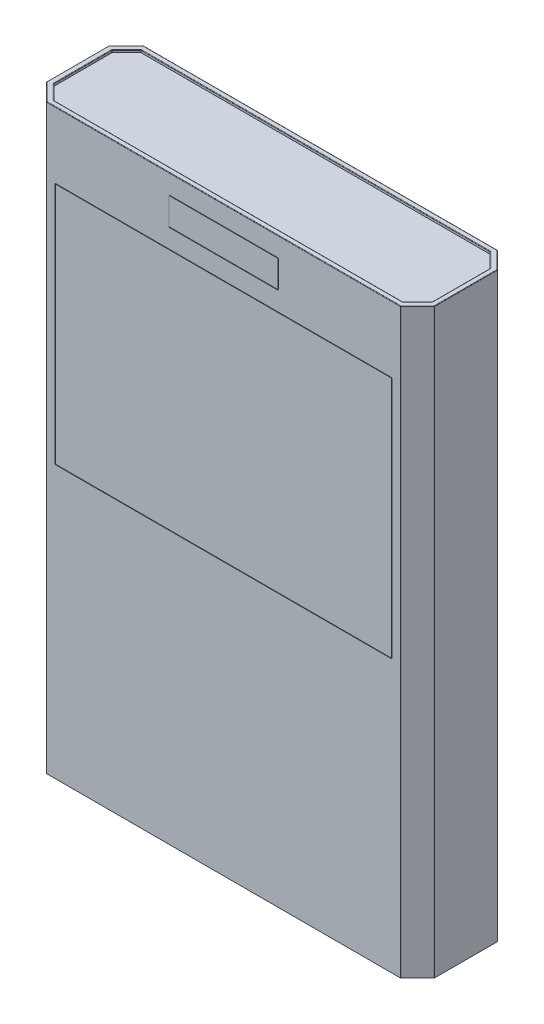
from build123d import *

# Parameters (mm, degrees)
SKETCH2_W           = 80
SKETCH2_H           = 120
BOSS_EXTRUDE1_DEPTH = 20
CHAMFER1_SIZE       = 3.5
CUT_EXTRUDE1_DEPTH  = 0.5
FILLET1_R           = 0.1
SKETCH4_W           = 22.384
SKETCH4_H           = 5.584
CUT_EXTRUDE2_DEPTH  = 0.1
SKETCH6_W           = 69.22
SKETCH6_H           = 50.02
CUT_EXTRUDE4_DEPTH  = 0.1


with BuildPart() as part:
    # Sketch2 → Boss-Extrude1 (new body)
    with BuildSketch(Plane.XY):
        Rectangle(SKETCH2_W, SKETCH2_H)
    extrude(amount=BOSS_EXTRUDE1_DEPTH)

    # Chamfer1
    chamfer1_edges = [part.edges().sort_by_distance(p)[0] for p in [
        (-40, 0, 20),
        (40, 0, 20),
        (-40, 0, 0),
        (40, 0, 0),
    ]]
    chamfer(chamfer1_edges, length=CHAMFER1_SIZE)

    # Sketch3 → Cut-Extrude1 (cut)
    with BuildSketch(Plane(origin=(0, 60, 0), x_dir=(1, 0, 0), z_dir=(0, 1, 0))):
        Polygon((-36, -19), (36, -19), (39, -16), (39, -4), (36, -1), (-36, -1), (-39, -4), (-39, -16), align=None)
    extrude(amount=-CUT_EXTRUDE1_DEPTH, mode=Mode.SUBTRACT)

    # Fillet1
    fillet1_edges = [part.edges().sort_by_distance(p)[0] for p in [
        (-40, 0, 16.5),
        (-40, 0, 3.5),
        (0, 60, 0),
        (36.5, 0, 0),
        (-36.5, 0, 0),
        (0, 60, 20),
        (40, 60, 10),
        (38.25, 60, 1.75),
        (38.25, 60, 18.25),
        (-38.25, 60, 18.25),
        (-38.25, 60, 1.75),
        (36.5, 0, 20),
        (-36.5, 0, 20),
        (40, 0, 3.5),
        (40, 0, 16.5),
        (-37.5, 60, 2.5),
        (-39, 59.75, 4),
        (0, 60, 1),
        (-36, 59.75, 1),
        (37.5, 60, 2.5),
        (36, 59.75, 1),
        (39, 59.75, 4),
        (39, 59.75, 16),
        (36, 59.75, 19),
        (-36, 59.75, 19),
        (-39, 60, 10),
        (-39, 59.75, 16),
        (-37.5, 60, 17.5),
        (0, 60, 19),
        (37.5, 60, 17.5),
        (39, 60, 10),
    ]]
    fillet(fillet1_edges, radius=FILLET1_R)

    # Sketch4 → Cut-Extrude2 (cut)
    with BuildSketch(Plane.XY.offset(20)):
        with BuildLine():
            Line((-11.192, 50.208), (11.192, 50.208))
            ThreePointArc((11.192, 50.208), (11.262710678, 50.237289322), (11.292, 50.308))
            Line((11.292, 50.308), (11.292, 55.892))
            ThreePointArc((11.292, 55.892), (11.262710678, 55.962710678), (11.192, 55.992))
            Line((11.192, 55.992), (-11.192, 55.992))
            ThreePointArc((-11.192, 55.992), (-11.262710678, 55.962710678), (-11.292, 55.892))
            Line((-11.292, 55.892), (-11.292, 50.308))
            ThreePointArc((-11.292, 50.308), (-11.262710678, 50.237289322), (-11.192, 50.208))
        make_face()
        with Locations((0, 53.1)):
            Rectangle(SKETCH4_W, SKETCH4_H, mode=Mode.SUBTRACT)
    extrude(amount=-CUT_EXTRUDE2_DEPTH, mode=Mode.SUBTRACT)

    # Sketch6 → Cut-Extrude4 (cut)
    with BuildSketch(Plane.XY.offset(20)):
        with BuildLine():
            ThreePointArc((-34.71, 46.218), (-34.680710678, 46.288710678), (-34.61, 46.318))
            Line((-34.61, 46.318), (34.61, 46.318))
            ThreePointArc((34.61, 46.318), (34.680710678, 46.288710678), (34.71, 46.218))
            Line((34.71, 46.218), (34.71, -3.802))
            ThreePointArc((34.71, -3.802), (34.680710678, -3.872710678), (34.61, -3.902))
            Line((34.61, -3.902), (-34.61, -3.902))
            ThreePointArc((-34.61, -3.902), (-34.680710678, -3.872710678), (-34.71, -3.802))
            Line((-34.71, -3.802), (-34.71, 46.218))
        make_face()
        with Locations((0, 21.208)):
            Rectangle(SKETCH6_W, SKETCH6_H, mode=Mode.SUBTRACT)
    extrude(amount=-CUT_EXTRUDE4_DEPTH, mode=Mode.SUBTRACT)


solid = part.part
